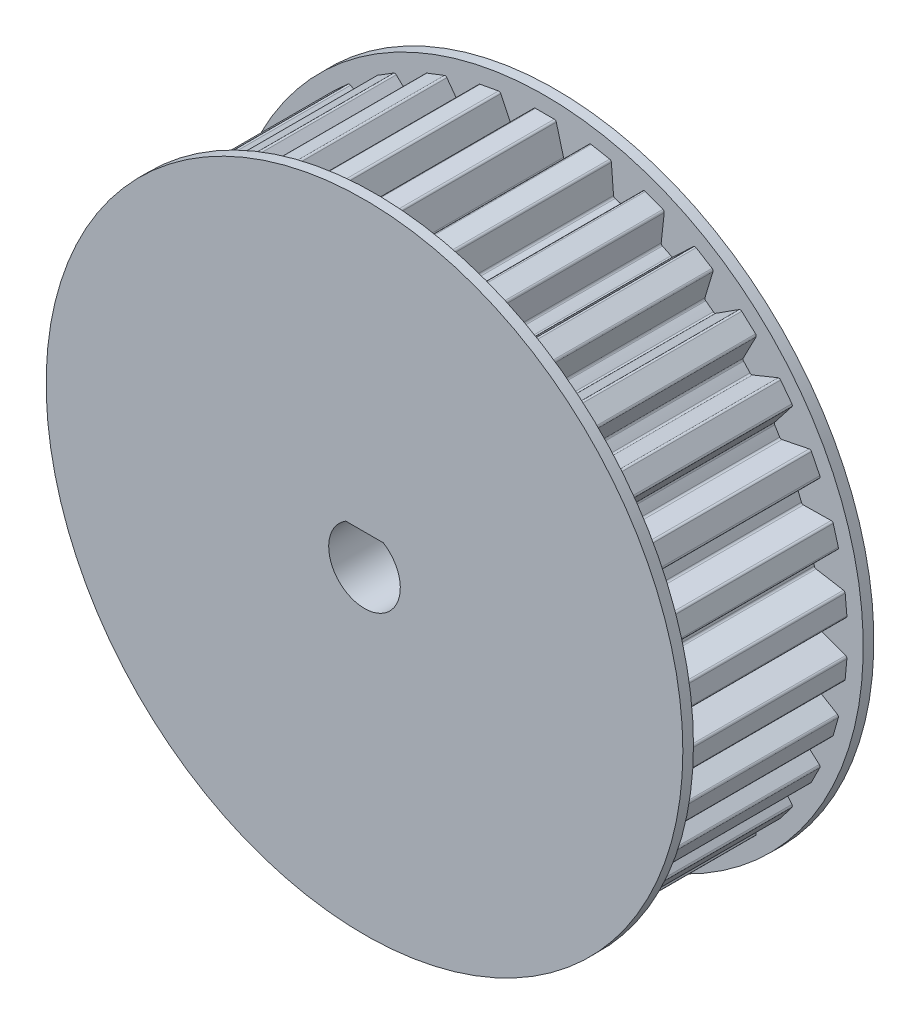
from build123d import *

# Parameters (mm, degrees)
BOSS_EXTRU_1_DEPTH      = 16
ESQUISSE3_R             = 30
BOSS_EXTRU_3_DEPTH      = 1
BOSS_EXTRU_4_START      = 1
ESQUISSE5_R             = 30
BOSS_EXTRU_4_DEPTH      = 1
CONG_1_R                = 0.2
ENL_V_MAT_EXTRU_1_DEPTH = 47.086874487


with BuildPart() as part:
    # Esquisse1 → Boss.-Extru.1 (new body)
    with BuildSketch(Plane.XY):
        with BuildLine():
            Line((1.03527618, 28.5), (-1.03527618, 28.5))
            Line((-1.03527618, 28.5), (-1.788804944, 25.687792371))
            ThreePointArc((-1.788804944, 25.687792371), (-2.375910256, 25.64015504), (-2.961772322, 25.579100936))
            Line((-2.961772322, 25.579100936), (-4.219212622, 28.20496484))
            Line((-4.219212622, 28.20496484), (-6.254509894, 27.824501842))
            Line((-6.254509894, 27.824501842), (-6.478466602, 24.921716845))
            ThreePointArc((-6.478466602, 24.921716845), (-7.046821994, 24.767010312), (-7.611489983, 24.599343899))
            Line((-7.611489983, 24.599343899), (-9.330021198, 26.94944343))
            Line((-9.330021198, 26.94944343), (-11.260753774, 26.201473646))
            Line((-11.260753774, 26.201473646), (-10.94751185, 23.306962142))
            ThreePointArc((-10.94751185, 23.306962142), (-11.477762661, 23.050454752), (-12.002007482, 22.781885708))
            Line((-12.002007482, 22.781885708), (-14.123107093, 24.776191047))
            Line((-14.123107093, 24.776191047), (-15.883526191, 23.686185689))
            Line((-15.883526191, 23.686185689), (-15.043752713, 20.898516797))
            ThreePointArc((-15.043752713, 20.898516797), (-15.517841887, 20.548943602), (-15.98381101, 20.188617723))
            Line((-15.98381101, 20.188617723), (-18.435247515, 21.759215194))
            Line((-18.435247515, 21.759215194), (-19.965404173, 20.364293088))
            Line((-19.965404173, 20.364293088), (-18.627696619, 17.778397528))
            ThreePointArc((-18.627696619, 17.778397528), (-19.029479618, 17.347662824), (-19.421305026, 16.907850576))
            Line((-19.421305026, 16.907850576), (-22.119597693, 18.001255364))
            Line((-22.119597693, 18.001255364), (-23.367384262, 16.34891891))
            Line((-23.367384262, 16.34891891), (-21.577296659, 14.052856253))
            ThreePointArc((-21.577296659, 14.052856253), (-21.893091245, 13.555628194), (-22.197429792, 13.051306856))
            Line((-22.197429792, 13.051306856), (-25.050691501, 13.630284373))
            Line((-25.050691501, 13.630284373), (-25.973616106, 11.776801907))
            Line((-25.973616106, 11.776801907), (-23.79210774, 9.848761814))
            ThreePointArc((-23.79210774, 9.848761814), (-24.011159907, 9.301972904), (-24.217647709, 8.750316534))
            Line((-24.217647709, 8.750316534), (-27.128714055, 8.795150395))
            Line((-27.128714055, 8.795150395), (-27.695347606, 6.803640039))
            Line((-27.695347606, 6.803640039), (-25.196707128, 5.309279603))
            ThreePointArc((-25.196707128, 5.309279603), (-25.311557317, 4.731550084), (-25.413162679, 4.151344677))
            Line((-25.413162679, 4.151344677), (-28.28290079, 3.660508119))
            Line((-28.28290079, 3.660508119), (-28.473947259, 1.59878837))
            Line((-28.473947259, 1.59878837), (-25.743262874, 0.588996243))
            ThreePointArc((-25.743262874, 0.588996243), (-25.75, 0), (-25.743262874, -0.588996243))
            Line((-25.743262874, -0.588996243), (-28.473947259, -1.59878837))
            Line((-28.473947259, -1.59878837), (-28.28290079, -3.660508119))
            Line((-28.28290079, -3.660508119), (-25.413162679, -4.151344677))
            ThreePointArc((-25.413162679, -4.151344677), (-25.311557317, -4.731550084), (-25.196707128, -5.309279603))
            Line((-25.196707128, -5.309279603), (-27.695347606, -6.803640039))
            Line((-27.695347606, -6.803640039), (-27.128714055, -8.795150395))
            Line((-27.128714055, -8.795150395), (-24.217647709, -8.750316534))
            ThreePointArc((-24.217647709, -8.750316534), (-24.011159907, -9.301972904), (-23.79210774, -9.848761814))
            Line((-23.79210774, -9.848761814), (-25.973616106, -11.776801907))
            Line((-25.973616106, -11.776801907), (-25.050691501, -13.630284373))
            Line((-25.050691501, -13.630284373), (-22.197429792, -13.051306856))
            ThreePointArc((-22.197429792, -13.051306856), (-21.893091245, -13.555628194), (-21.577296659, -14.052856253))
            Line((-21.577296659, -14.052856253), (-23.367384262, -16.34891891))
            Line((-23.367384262, -16.34891891), (-22.119597693, -18.001255364))
            Line((-22.119597693, -18.001255364), (-19.421305026, -16.907850576))
            ThreePointArc((-19.421305026, -16.907850576), (-19.029479618, -17.347662824), (-18.627696619, -17.778397528))
            Line((-18.627696619, -17.778397528), (-19.965404173, -20.364293088))
            Line((-19.965404173, -20.364293088), (-18.435247515, -21.759215194))
            Line((-18.435247515, -21.759215194), (-15.98381101, -20.188617723))
            ThreePointArc((-15.98381101, -20.188617723), (-15.517841887, -20.548943602), (-15.043752713, -20.898516797))
            Line((-15.043752713, -20.898516797), (-15.883526191, -23.686185689))
            Line((-15.883526191, -23.686185689), (-14.123107093, -24.776191047))
            Line((-14.123107093, -24.776191047), (-12.002007482, -22.781885708))
            ThreePointArc((-12.002007482, -22.781885708), (-11.477762661, -23.050454752), (-10.94751185, -23.306962142))
            Line((-10.94751185, -23.306962142), (-11.260753774, -26.201473646))
            Line((-11.260753774, -26.201473646), (-9.330021198, -26.94944343))
            Line((-9.330021198, -26.94944343), (-7.611489983, -24.599343899))
            ThreePointArc((-7.611489983, -24.599343899), (-7.046821994, -24.767010312), (-6.478466602, -24.921716845))
            Line((-6.478466602, -24.921716845), (-6.254509894, -27.824501842))
            Line((-6.254509894, -27.824501842), (-4.219212622, -28.20496484))
            Line((-4.219212622, -28.20496484), (-2.961772322, -25.579100936))
            ThreePointArc((-2.961772322, -25.579100936), (-2.375910256, -25.64015504), (-1.788804944, -25.687792371))
            Line((-1.788804944, -25.687792371), (-1.03527618, -28.5))
            Line((-1.03527618, -28.5), (0, -28.5))
            Line((0, -28.5), (1.03527618, -28.5))
            Line((1.03527618, -28.5), (1.788804944, -25.687792371))
            ThreePointArc((1.788804944, -25.687792371), (2.375910256, -25.64015504), (2.961772322, -25.579100936))
            Line((2.961772322, -25.579100936), (4.219212622, -28.20496484))
            Line((4.219212622, -28.20496484), (6.254509894, -27.824501842))
            Line((6.254509894, -27.824501842), (6.478466602, -24.921716845))
            ThreePointArc((6.478466602, -24.921716845), (7.046821994, -24.767010312), (7.611489983, -24.599343899))
            Line((7.611489983, -24.599343899), (9.330021198, -26.94944343))
            Line((9.330021198, -26.94944343), (11.260753774, -26.201473646))
            Line((11.260753774, -26.201473646), (10.94751185, -23.306962142))
            ThreePointArc((10.94751185, -23.306962142), (11.477762661, -23.050454752), (12.002007482, -22.781885708))
            Line((12.002007482, -22.781885708), (14.123107093, -24.776191047))
            Line((14.123107093, -24.776191047), (15.883526191, -23.686185689))
            Line((15.883526191, -23.686185689), (15.043752713, -20.898516797))
            ThreePointArc((15.043752713, -20.898516797), (15.517841887, -20.548943602), (15.98381101, -20.188617723))
            Line((15.98381101, -20.188617723), (18.435247515, -21.759215194))
            Line((18.435247515, -21.759215194), (19.965404173, -20.364293088))
            Line((19.965404173, -20.364293088), (18.627696619, -17.778397528))
            ThreePointArc((18.627696619, -17.778397528), (19.029479618, -17.347662824), (19.421305026, -16.907850576))
            Line((19.421305026, -16.907850576), (22.119597693, -18.001255364))
            Line((22.119597693, -18.001255364), (23.367384262, -16.34891891))
            Line((23.367384262, -16.34891891), (21.577296659, -14.052856253))
            ThreePointArc((21.577296659, -14.052856253), (21.893091245, -13.555628194), (22.197429792, -13.051306856))
            Line((22.197429792, -13.051306856), (25.050691501, -13.630284373))
            Line((25.050691501, -13.630284373), (25.973616106, -11.776801907))
            Line((25.973616106, -11.776801907), (23.79210774, -9.848761814))
            ThreePointArc((23.79210774, -9.848761814), (24.011159907, -9.301972904), (24.217647709, -8.750316534))
            Line((24.217647709, -8.750316534), (27.128714055, -8.795150395))
            Line((27.128714055, -8.795150395), (27.695347606, -6.803640039))
            Line((27.695347606, -6.803640039), (25.196707128, -5.309279603))
            ThreePointArc((25.196707128, -5.309279603), (25.311557317, -4.731550084), (25.413162679, -4.151344677))
            Line((25.413162679, -4.151344677), (28.28290079, -3.660508119))
            Line((28.28290079, -3.660508119), (28.473947259, -1.59878837))
            Line((28.473947259, -1.59878837), (25.743262874, -0.588996243))
            ThreePointArc((25.743262874, -0.588996243), (25.75, 0), (25.743262874, 0.588996243))
            Line((25.743262874, 0.588996243), (28.473947259, 1.59878837))
            Line((28.473947259, 1.59878837), (28.28290079, 3.660508119))
            Line((28.28290079, 3.660508119), (25.413162679, 4.151344677))
            ThreePointArc((25.413162679, 4.151344677), (25.311557317, 4.731550084), (25.196707128, 5.309279603))
            Line((25.196707128, 5.309279603), (27.695347606, 6.803640039))
            Line((27.695347606, 6.803640039), (27.128714055, 8.795150395))
            Line((27.128714055, 8.795150395), (24.217647709, 8.750316534))
            ThreePointArc((24.217647709, 8.750316534), (24.011159907, 9.301972904), (23.79210774, 9.848761814))
            Line((23.79210774, 9.848761814), (25.973616106, 11.776801907))
            Line((25.973616106, 11.776801907), (25.050691501, 13.630284373))
            Line((25.050691501, 13.630284373), (22.197429792, 13.051306856))
            ThreePointArc((22.197429792, 13.051306856), (21.893091245, 13.555628194), (21.577296659, 14.052856253))
            Line((21.577296659, 14.052856253), (23.367384262, 16.34891891))
            Line((23.367384262, 16.34891891), (22.119597693, 18.001255364))
            Line((22.119597693, 18.001255364), (19.421305026, 16.907850576))
            ThreePointArc((19.421305026, 16.907850576), (19.029479618, 17.347662824), (18.627696619, 17.778397528))
            Line((18.627696619, 17.778397528), (19.965404173, 20.364293088))
            Line((19.965404173, 20.364293088), (18.435247515, 21.759215194))
            Line((18.435247515, 21.759215194), (15.98381101, 20.188617723))
            ThreePointArc((15.98381101, 20.188617723), (15.517841887, 20.548943602), (15.043752713, 20.898516797))
            Line((15.043752713, 20.898516797), (15.883526191, 23.686185689))
            Line((15.883526191, 23.686185689), (14.123107093, 24.776191047))
            Line((14.123107093, 24.776191047), (12.002007482, 22.781885708))
            ThreePointArc((12.002007482, 22.781885708), (11.477762661, 23.050454752), (10.94751185, 23.306962142))
            Line((10.94751185, 23.306962142), (11.260753774, 26.201473646))
            Line((11.260753774, 26.201473646), (9.330021198, 26.94944343))
            Line((9.330021198, 26.94944343), (7.611489983, 24.599343899))
            ThreePointArc((7.611489983, 24.599343899), (7.046821994, 24.767010312), (6.478466602, 24.921716845))
            Line((6.478466602, 24.921716845), (6.254509894, 27.824501842))
            Line((6.254509894, 27.824501842), (4.219212622, 28.20496484))
            Line((4.219212622, 28.20496484), (2.961772322, 25.579100936))
            ThreePointArc((2.961772322, 25.579100936), (2.375910256, 25.64015504), (1.788804944, 25.687792371))
            Line((1.788804944, 25.687792371), (1.03527618, 28.5))
        make_face()
    extrude(amount=BOSS_EXTRU_1_DEPTH)

    # Esquisse3 → Boss.-Extru.3 (add)
    with BuildSketch(Plane.XY.offset(16)):
        Circle(ESQUISSE3_R)
    extrude(amount=BOSS_EXTRU_3_DEPTH)

    # Esquisse5 → Boss.-Extru.4 (add)
    with BuildSketch(Plane(origin=(0, 0, 0), x_dir=(-1, 0, 0), z_dir=(0, 0, -1)).offset(BOSS_EXTRU_4_START)):
        with Locations(Location((0, 0, 0), (0, 0, 180))):
            Circle(ESQUISSE5_R)
    extrude(amount=-BOSS_EXTRU_4_DEPTH)

    # Congé1
    cong_1_edges = [part.edges().sort_by_distance(p)[0] for p in [
        (4.219212622, 28.20496484, 8),
        (6.254509894, 27.824501842, 8),
        (6.478466602, 24.921716845, 8),
        (7.611489983, 24.599343899, 8),
        (9.330021198, 26.94944343, 8),
        (11.260753774, 26.201473646, 8),
        (10.94751185, 23.306962142, 8),
        (12.002007482, 22.781885708, 8),
        (14.123107093, 24.776191047, 8),
        (15.883526191, 23.686185689, 8),
        (15.043752713, 20.898516797, 8),
        (15.98381101, 20.188617723, 8),
        (18.435247515, 21.759215194, 8),
        (19.965404173, 20.364293088, 8),
        (18.627696619, 17.778397528, 8),
        (19.421305026, 16.907850576, 8),
        (22.119597693, 18.001255364, 8),
        (23.367384262, 16.34891891, 8),
        (21.577296659, 14.052856253, 8),
        (22.197429792, 13.051306856, 8),
        (25.050691501, 13.630284373, 8),
        (25.973616106, 11.776801907, 8),
        (23.79210774, 9.848761814, 8),
        (24.217647709, 8.750316534, 8),
        (27.128714055, 8.795150395, 8),
        (27.695347606, 6.803640039, 8),
        (25.196707128, 5.309279603, 8),
        (25.413162679, 4.151344677, 8),
        (28.28290079, 3.660508119, 8),
        (28.473947259, 1.59878837, 8),
        (25.743262874, 0.588996243, 8),
        (25.743262874, -0.588996243, 8),
        (28.473947259, -1.59878837, 8),
        (28.28290079, -3.660508119, 8),
        (25.413162679, -4.151344677, 8),
        (25.196707128, -5.309279603, 8),
        (27.695347606, -6.803640039, 8),
        (27.128714055, -8.795150395, 8),
        (24.217647709, -8.750316534, 8),
        (23.79210774, -9.848761814, 8),
        (25.973616106, -11.776801907, 8),
        (25.050691501, -13.630284373, 8),
        (22.197429792, -13.051306856, 8),
        (21.577296659, -14.052856253, 8),
        (23.367384262, -16.34891891, 8),
        (22.119597693, -18.001255364, 8),
        (19.421305026, -16.907850576, 8),
        (18.627696619, -17.778397528, 8),
        (19.965404173, -20.364293088, 8),
        (18.435247515, -21.759215194, 8),
        (15.98381101, -20.188617723, 8),
        (15.043752713, -20.898516797, 8),
        (15.883526191, -23.686185689, 8),
        (14.123107093, -24.776191047, 8),
        (12.002007482, -22.781885708, 8),
        (10.94751185, -23.306962142, 8),
        (11.260753774, -26.201473646, 8),
        (9.330021198, -26.94944343, 8),
        (7.611489983, -24.599343899, 8),
        (6.478466602, -24.921716845, 8),
        (6.254509894, -27.824501842, 8),
        (4.219212622, -28.20496484, 8),
        (2.961772322, -25.579100936, 8),
        (1.788804944, -25.687792371, 8),
        (1.03527618, -28.5, 8),
        (-1.03527618, -28.5, 8),
        (-1.788804944, -25.687792371, 8),
        (-2.961772322, -25.579100936, 8),
        (-4.219212622, -28.20496484, 8),
        (-6.254509894, -27.824501842, 8),
        (-6.478466602, -24.921716845, 8),
        (-7.611489983, -24.599343899, 8),
        (-9.330021198, -26.94944343, 8),
        (-11.260753774, -26.201473646, 8),
        (-10.94751185, -23.306962142, 8),
        (-12.002007482, -22.781885708, 8),
        (-14.123107093, -24.776191047, 8),
        (-15.883526191, -23.686185689, 8),
        (-15.043752713, -20.898516797, 8),
        (-15.98381101, -20.188617723, 8),
        (-18.435247515, -21.759215194, 8),
        (-19.965404173, -20.364293088, 8),
        (-18.627696619, -17.778397528, 8),
        (-19.421305026, -16.907850576, 8),
        (-22.119597693, -18.001255364, 8),
        (-23.367384262, -16.34891891, 8),
        (-21.577296659, -14.052856253, 8),
        (-22.197429792, -13.051306856, 8),
        (-25.050691501, -13.630284373, 8),
        (-25.973616106, -11.776801907, 8),
        (-23.79210774, -9.848761814, 8),
        (-24.217647709, -8.750316534, 8),
        (-27.128714055, -8.795150395, 8),
        (-27.695347606, -6.803640039, 8),
        (-25.196707128, -5.309279603, 8),
        (-25.413162679, -4.151344677, 8),
        (-28.28290079, -3.660508119, 8),
        (-28.473947259, -1.59878837, 8),
        (-25.743262874, -0.588996243, 8),
        (-25.743262874, 0.588996243, 8),
        (-28.473947259, 1.59878837, 8),
        (-28.28290079, 3.660508119, 8),
        (-25.413162679, 4.151344677, 8),
        (-25.196707128, 5.309279603, 8),
        (-27.695347606, 6.803640039, 8),
        (-27.128714055, 8.795150395, 8),
        (-24.217647709, 8.750316534, 8),
        (-23.79210774, 9.848761814, 8),
        (-25.973616106, 11.776801907, 8),
        (-25.050691501, 13.630284373, 8),
        (-22.197429792, 13.051306856, 8),
        (-21.577296659, 14.052856253, 8),
        (-23.367384262, 16.34891891, 8),
        (-22.119597693, 18.001255364, 8),
        (-19.421305026, 16.907850576, 8),
        (-18.627696619, 17.778397528, 8),
        (-19.965404173, 20.364293088, 8),
        (-18.435247515, 21.759215194, 8),
        (-15.98381101, 20.188617723, 8),
        (-15.043752713, 20.898516797, 8),
        (-15.883526191, 23.686185689, 8),
        (-14.123107093, 24.776191047, 8),
        (-12.002007482, 22.781885708, 8),
        (-10.94751185, 23.306962142, 8),
        (-11.260753774, 26.201473646, 8),
        (-9.330021198, 26.94944343, 8),
        (-7.611489983, 24.599343899, 8),
        (-6.478466602, 24.921716845, 8),
        (-6.254509894, 27.824501842, 8),
        (-4.219212622, 28.20496484, 8),
        (-2.961772322, 25.579100936, 8),
        (-1.788804944, 25.687792371, 8),
        (-1.03527618, 28.5, 8),
        (1.03527618, 28.5, 8),
        (1.788804944, 25.687792371, 8),
        (2.961772322, 25.579100936, 8),
    ]]
    fillet(cong_1_edges, radius=CONG_1_R)

    # Esquisse6 → Enlèv. mat.-Extru.1 (cut, through all)
    with BuildSketch(Plane.XY.offset(17)):
        with BuildLine():
            Line((-1.767766953, 2.875), (1.767766953, 2.875))
            ThreePointArc((1.767766953, 2.875), (0, -3.375), (-1.767766953, 2.875))
        make_face()
    extrude(amount=-ENL_V_MAT_EXTRU_1_DEPTH, mode=Mode.SUBTRACT)


solid = part.part
